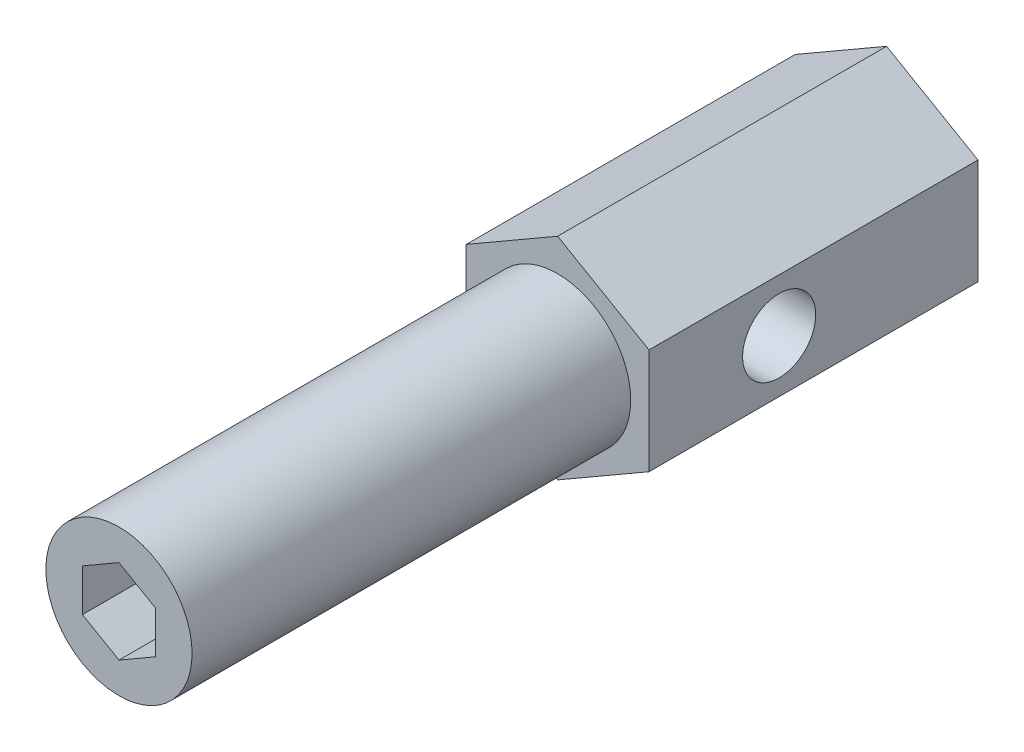
from build123d import *

# Parameters (mm, degrees)
BOSS_EXTRUDE1_DEPTH      = 152.4
BOSS_EXTRUDE1_DEPTH_BACK = 152.4
CUT_EXTRUDE1_DEPTH       = 171.45
CUT_EXTRUDE2_DEPTH       = 40.132
SKETCH6_R                = 18.330871047
SKETCH6_R_2              = 12.7
CUT_EXTRUDE3_DEPTH       = 76.2
SKETCH7_R                = 6.35
CUT_EXTRUDE4_DEPTH       = 157.747705991


with BuildPart() as part:
    # Sketch3 → Boss-Extrude1 (new, two sides: drawn at the far end of the back side and taken through both)
    with BuildSketch(Plane.XY.offset(-BOSS_EXTRUDE1_DEPTH_BACK)):
        Polygon((0, 18.330871047), (-15.875, 9.165435523), (-15.875, -9.165435523), (0, -18.330871047), (15.875, -9.165435523), (15.875, 9.165435523), align=None)
    extrude(amount=BOSS_EXTRUDE1_DEPTH + BOSS_EXTRUDE1_DEPTH_BACK)

    # Sketch4 → Cut-Extrude1 (cut)
    with BuildSketch(Plane(origin=(0, 0, -152.4), x_dir=(-1, 0, 0), z_dir=(0, 0, -1))):
        Polygon((0, 18.330871047), (-15.875, 9.165435523), (-15.875, -9.165435523), (0, -18.330871047), (15.875, -9.165435523), (15.875, 9.165435523), align=None)
    extrude(amount=-CUT_EXTRUDE1_DEPTH, mode=Mode.SUBTRACT)

    # Sketch5 → Cut-Extrude2 (cut)
    with BuildSketch(Plane.XY.offset(152.4)):
        Polygon((0, 7.332348419), (-6.35, 3.666174209), (-6.35, -3.666174209), (0, -7.332348419), (6.35, -3.666174209), (6.35, 3.666174209), align=None)
    extrude(amount=-CUT_EXTRUDE2_DEPTH, mode=Mode.SUBTRACT)

    # Sketch6 → Cut-Extrude3 (cut)
    with BuildSketch(Plane.XY.offset(152.4)):
        Circle(SKETCH6_R)
        Circle(SKETCH6_R_2, mode=Mode.SUBTRACT)
    extrude(amount=-CUT_EXTRUDE3_DEPTH, mode=Mode.SUBTRACT)

    # Sketch7 → Cut-Extrude4 (cut, through all)
    with BuildSketch(Plane(origin=(15.875, 0, 0), x_dir=(0, 0, -1), z_dir=(1, 0, 0))):
        with Locations((-53.594, 0)):
            Circle(SKETCH7_R)
    extrude(amount=-CUT_EXTRUDE4_DEPTH, mode=Mode.SUBTRACT)


solid = part.part
